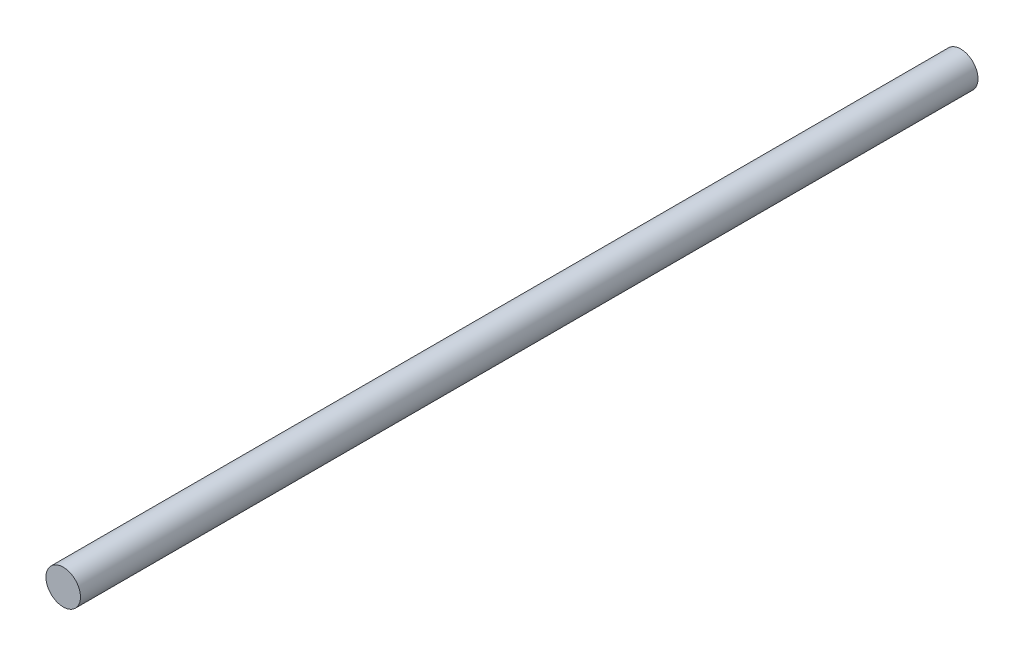
from build123d import *

# Parameters (mm, degrees)
SKETCH1_R           = 5
BOSS_EXTRUDE1_DEPTH = 250
SKETCH2_R           = 5
BOSS_EXTRUDE2_DEPTH = 10


with BuildPart() as part:
    # Sketch1 → Boss-Extrude1 (new body)
    with BuildSketch(Plane.XY):
        Circle(SKETCH1_R)
    extrude(amount=BOSS_EXTRUDE1_DEPTH)

    # Sketch2 → Boss-Extrude2 (add)
    with BuildSketch(Plane.XY.offset(250)):
        Circle(SKETCH2_R)
    extrude(amount=BOSS_EXTRUDE2_DEPTH)


solid = part.part
